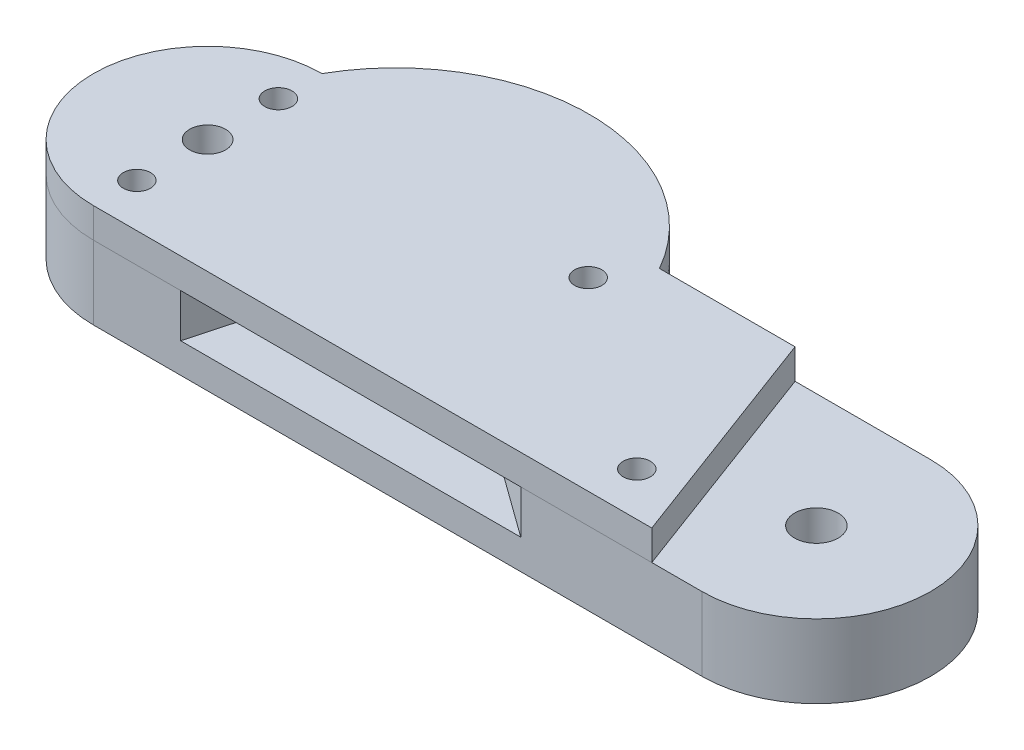
from build123d import *

# Parameters (mm, degrees)
SKETCH1_R                       = 2
SKETCH1_R_2                     = 1.65
BOSS_EXTRUDE1_DEPTH             = 4.75
CUT_EXTRUDE1_DEPTH              = 2
BOSS_EXTRUDE2_REACH             = 69.423
BOSS_EXTRUDE2_DIRECTION_2_REACH = 69.423
CUT_EXTRUDE2_DEPTH              = 2
SKETCH7_R                       = 1.25
CUT_EXTRUDE3_DEPTH              = 70.897349716
SKETCH8_R                       = 2.75
CUT_EXTRUDE4_DEPTH              = 3.2
CUT_EXTRUDE5_DEPTH              = 2.75


with BuildPart() as part:
    # Sketch1 → Boss-Extrude1 (new, symmetric)
    with BuildSketch(Plane(origin=(0, 0, 0), x_dir=(1, 0, 0), z_dir=(0, 1, 0))):
        with BuildLine():
            Line((0, -10.500399217), (-55.93053828, -10.500399217))
            ThreePointArc((-55.93053828, -10.500399217), (-66.430937497, 0), (-55.93053828, 10.500399217))
            Line((-55.93053828, 10.500399217), (0, 10.500399217))
            ThreePointArc((0, 10.500399217), (10.500399217, 0), (0, -10.500399217))
        make_face()
        with Locations(Location((0, 0, 0), (0, 0, 270))):
            Circle(SKETCH1_R, mode=Mode.SUBTRACT)
        with Locations(Location((-55.93053828, 0, 0), (0, 0, 270))):
            Circle(SKETCH1_R_2, mode=Mode.SUBTRACT)
    extrude(amount=BOSS_EXTRUDE1_DEPTH, both=True)

    # Sketch3 → Cut-Extrude1 (cut, symmetric)
    with BuildSketch(Plane(origin=(0, 0, 0), x_dir=(1, 0, 0), z_dir=(0, 1, 0))):
        with BuildLine():
            Line((-35.751827911, 18.875253657), (-39.299525946, 5.868950542))
            Line((-39.299525946, 5.868950542), (26.645239155, -41.810424095))
            ThreePointArc((26.645239155, -41.810424095), (-18.563858299, -45.972421055), (-48.206523525, -11.584965354))
            Line((-48.206523525, -11.584965354), (-43.887265107, 4.249974277))
            Line((-43.887265107, 4.249974277), (-54.812276631, 12.148974547))
            ThreePointArc((-54.812276631, 12.148974547), (-46.585078234, 19.204535889), (-35.751827911, 18.875253657))
        make_face()
    extrude(amount=CUT_EXTRUDE1_DEPTH, both=True, mode=Mode.SUBTRACT)

    # Boss-Extrude2: up to this face of the body (flat: up to its plane)
    boss_extrude2_end = Plane(part.part.faces().sort_by_distance((-28.040100034, 4.75, 0))[0])
    # Sketch5 → Boss-Extrude2 (add, up to the picked face)
    with BuildSketch(Plane(origin=(0, 0, 0), x_dir=(1, 0, 0), z_dir=(0, 1, 0)), mode=Mode.PRIVATE) as boss_extrude2_sk1:
        with BuildLine():
            ThreePointArc((-24.917700351, 10.500399217), (-40.424119316, 19.553005923), (-55.93053828, 10.500399217))
            Line((-55.93053828, 10.500399217), (-24.917700351, 10.500399217))
        make_face()
    boss_extrude2_tool1 = split(extrude(boss_extrude2_sk1.sketch, amount=BOSS_EXTRUDE2_REACH, mode=Mode.PRIVATE), bisect_by=boss_extrude2_end, keep=Keep.BOTH, mode=Mode.PRIVATE)
    add(boss_extrude2_tool1.solids().sort_by(Axis((-40.424119, 0, -14.214125), (0, 1, 0)))[0])

    # Boss-Extrude2 direction 2: up to this face of the body (flat: up to its plane)
    boss_extrude2_direction_2_end = Plane(part.part.faces().sort_by_distance((-28.040100034, -4.75, 0))[0])
    # Sketch5 → Boss-Extrude2 direction 2 (add, up to the picked face)
    with BuildSketch(Plane(origin=(0, 0, 0), x_dir=(1, 0, 0), z_dir=(0, 1, 0)), mode=Mode.PRIVATE) as boss_extrude2_direction_2_sk1:
        with BuildLine():
            ThreePointArc((-24.917700351, 10.500399217), (-40.424119316, 19.553005923), (-55.93053828, 10.500399217))
            Line((-55.93053828, 10.500399217), (-24.917700351, 10.500399217))
        make_face()
    boss_extrude2_direction_2_tool1 = split(extrude(boss_extrude2_direction_2_sk1.sketch, amount=-BOSS_EXTRUDE2_DIRECTION_2_REACH, mode=Mode.PRIVATE), bisect_by=boss_extrude2_direction_2_end, keep=Keep.BOTH, mode=Mode.PRIVATE)
    add(boss_extrude2_direction_2_tool1.solids().sort_by(Axis((-40.424119, 0, -14.214125), (0, -1, 0)))[0])

    # Sketch6 → Cut-Extrude2 (cut, symmetric)
    with BuildSketch(Plane(origin=(0, 0, 0), x_dir=(1, 0, 0), z_dir=(0, 1, 0))):
        with BuildLine():
            Line((-39.299525946, 5.868950542), (-16.659276721, -10.500399217))
            Line((-16.659276721, -10.500399217), (-47.910689027, -10.500399217))
            Line((-47.910689027, -10.500399217), (-43.887265107, 4.249974277))
            Line((-43.887265107, 4.249974277), (-54.854382526, 12.179417945))
            ThreePointArc((-54.854382526, 12.179417945), (-46.349897212, 18.538096729), (-35.738154791, 18.925381021))
            Line((-35.738154791, 18.925381021), (-39.299525946, 5.868950542))
        make_face()
    extrude(amount=CUT_EXTRUDE2_DEPTH, both=True, mode=Mode.SUBTRACT)

    # Sketch7 → Cut-Extrude3 (cut, through all)
    with BuildSketch(Plane.XZ.offset(4.75)):
        with Locations(Location((-27.461551073, -6.500399217, 0), (0, 0, 270))):
            Circle(SKETCH7_R)
        with Locations(Location((-10, 6.500399217, 0), (0, 0, 270))):
            Circle(SKETCH7_R)
        with Locations(Location((-55.93053828, 6.500399217, 0), (0, 0, 270))):
            Circle(SKETCH7_R)
        with Locations(Location((-55.93053828, -6.500399217, 0), (0, 0, 270))):
            Circle(SKETCH7_R)
    extrude(amount=-CUT_EXTRUDE3_DEPTH, mode=Mode.SUBTRACT)

    # Sketch8 → Cut-Extrude4 (cut)
    with BuildSketch(Plane.XZ.offset(4.75)):
        with Locations(Location((-55.93053828, 6.500399217, 0), (0, 0, 270))):
            Circle(SKETCH8_R)
        with Locations(Location((-55.93053828, -6.500399217, 0), (0, 0, 270))):
            Circle(SKETCH8_R)
        with Locations(Location((-27.461551073, -6.500399217, 0), (0, 0, 270))):
            Circle(SKETCH8_R)
        with Locations(Location((-10, 6.500399217, 0), (0, 0, 270))):
            Circle(SKETCH8_R)
    extrude(amount=-CUT_EXTRUDE4_DEPTH, mode=Mode.SUBTRACT)

    # Sketch9 → Cut-Extrude5 (cut)
    with BuildSketch(Plane(origin=(0, 4.75, 0), x_dir=(1, 0, 0), z_dir=(0, 1, 0))):
        with BuildLine():
            Line((-12.458850176, 10.500399217), (-4.619547141, -10.500399217))
            Line((-4.619547141, -10.500399217), (0, -10.500399217))
            ThreePointArc((0, -10.500399217), (10.500399217, 0), (0, 10.500399217))
            Line((0, 10.500399217), (-12.458850176, 10.500399217))
        make_face()
    extrude(amount=-CUT_EXTRUDE5_DEPTH, mode=Mode.SUBTRACT)


with BuildPart() as body_2:
    # Split1: the piece on the far side of the plane
    add(part.part)
    split(bisect_by=Plane(origin=(0, 2, 0), x_dir=(0, 0, -1), z_dir=(0, -1, 0)), keep=Keep.BOTTOM)


with BuildPart() as part_1:
    add(part.part)

    # Split1
    split(bisect_by=Plane(origin=(0, 2, 0), x_dir=(0, 0, -1), z_dir=(0, -1, 0)), keep=Keep.TOP)


solid = Compound([body_2.part, part_1.part])
